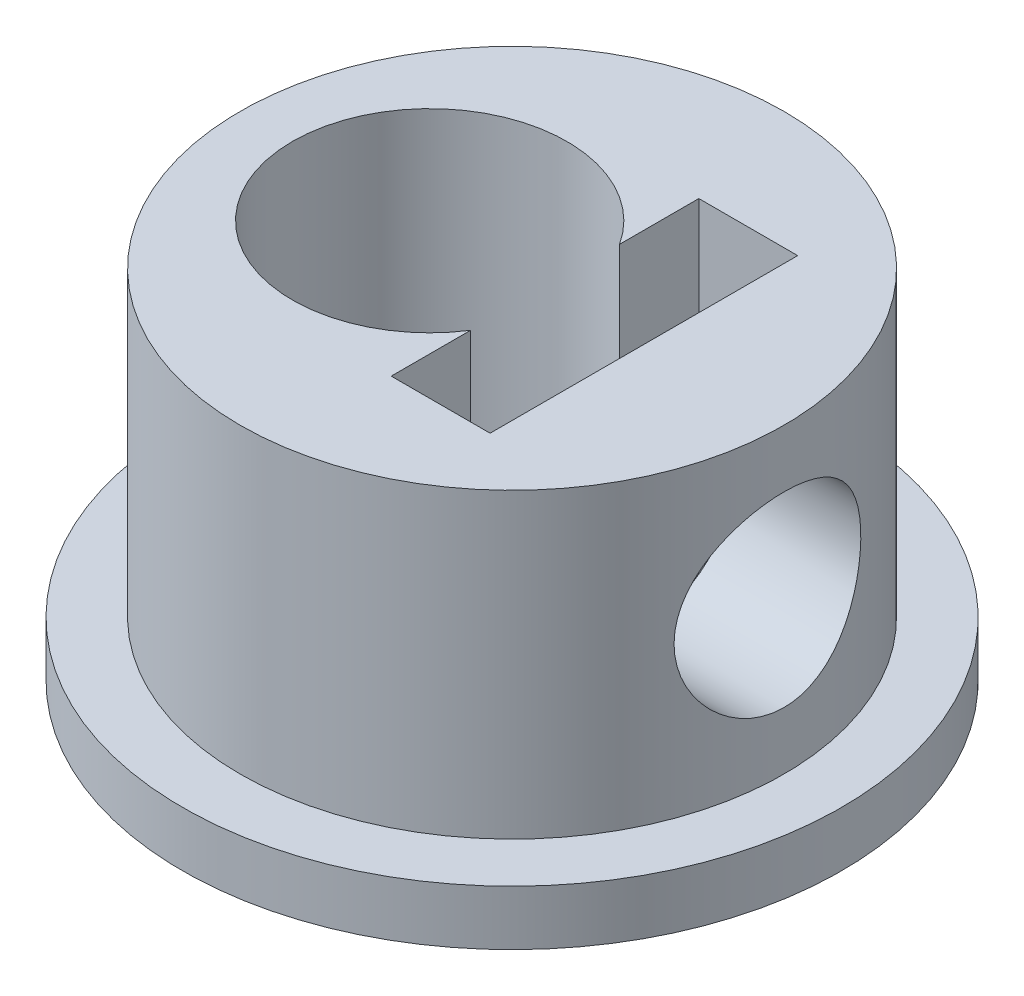
from build123d import *

# Parameters (mm, degrees)
SKETCH1_R           = 2.5
BOSS_EXTRUDE1_DEPTH = 15
SKETCH2_R           = 4.95
BOSS_EXTRUDE2_DEPTH = 5.5
SKETCH7_W           = 1.8
SKETCH7_H           = 5.6
CUT_EXTRUDE3_DEPTH  = 5.5
SKETCH10_R          = 2.5
CUT_EXTRUDE4_DEPTH  = 23.053457779
SKETCH13_W          = 1.7
SKETCH13_H          = 2.55
BOSS_EXTRUDE5_START = 1
SKETCH14_R          = 6
BOSS_EXTRUDE5_DEPTH = 1


with BuildPart() as part:
    # Sketch1 → Boss-Extrude1 (new body)
    with BuildSketch(Plane(origin=(0, 0, 0), x_dir=(1, 0, 0), z_dir=(0, 1, 0))):
        with Locations(Location((0, 0, 0), (0, 0, 270))):
            Circle(SKETCH1_R)
    extrude(amount=BOSS_EXTRUDE1_DEPTH)

    # Sketch2 → Boss-Extrude2 (add)
    with BuildSketch(Plane(origin=(0, 15, 0), x_dir=(1, 0, 0), z_dir=(0, 1, 0))):
        with Locations(Location((1.5, 0, 0), (0, 0, 270))):
            Circle(SKETCH2_R)
    extrude(amount=BOSS_EXTRUDE2_DEPTH)

    # Sketch7 → Cut-Extrude3 (cut)
    with BuildSketch(Plane.XZ.offset(-15)):
        with Locations((3, 0)):
            Rectangle(SKETCH7_W, SKETCH7_H)
    extrude(amount=-CUT_EXTRUDE3_DEPTH, mode=Mode.SUBTRACT)

    # Sketch10 → Cut-Extrude4 (cut, through all)
    with BuildSketch(Plane.XZ):
        Circle(SKETCH10_R)
    extrude(amount=-CUT_EXTRUDE4_DEPTH, mode=Mode.SUBTRACT)

    # Sketch13 → M3 Clearance Hole1 (revolve, cut)
    with BuildSketch(Plane(origin=(3.9, 17.75, 0), x_dir=(0, 0, 1), z_dir=(0, 1, 0))):
        with Locations((0.85, 1.275)):
            Rectangle(SKETCH13_W, SKETCH13_H)
    revolve(axis=Axis((-2.45, 17.75, 0), (1, 0, 0)), mode=Mode.SUBTRACT)

    # Sketch14 → Boss-Extrude5 (add)
    with BuildSketch(Plane.XZ.offset(-15).offset(BOSS_EXTRUDE5_START)):
        with Locations(Location((1.5, 0, 0), (0, 0, 270))):
            Circle(SKETCH14_R)
        with BuildLine():
            Line((2.1, 2.8), (2.1, 1.356465997))
            ThreePointArc((2.1, 1.356465997), (-2.5, 0), (2.1, -1.356465997))
            Line((2.1, -1.356465997), (2.1, -2.8))
            Line((2.1, -2.8), (3.9, -2.8))
            Line((3.9, -2.8), (3.9, 2.8))
            Line((3.9, 2.8), (2.1, 2.8))
        make_face(mode=Mode.SUBTRACT)
    extrude(amount=-BOSS_EXTRUDE5_DEPTH)


solid = part.part
